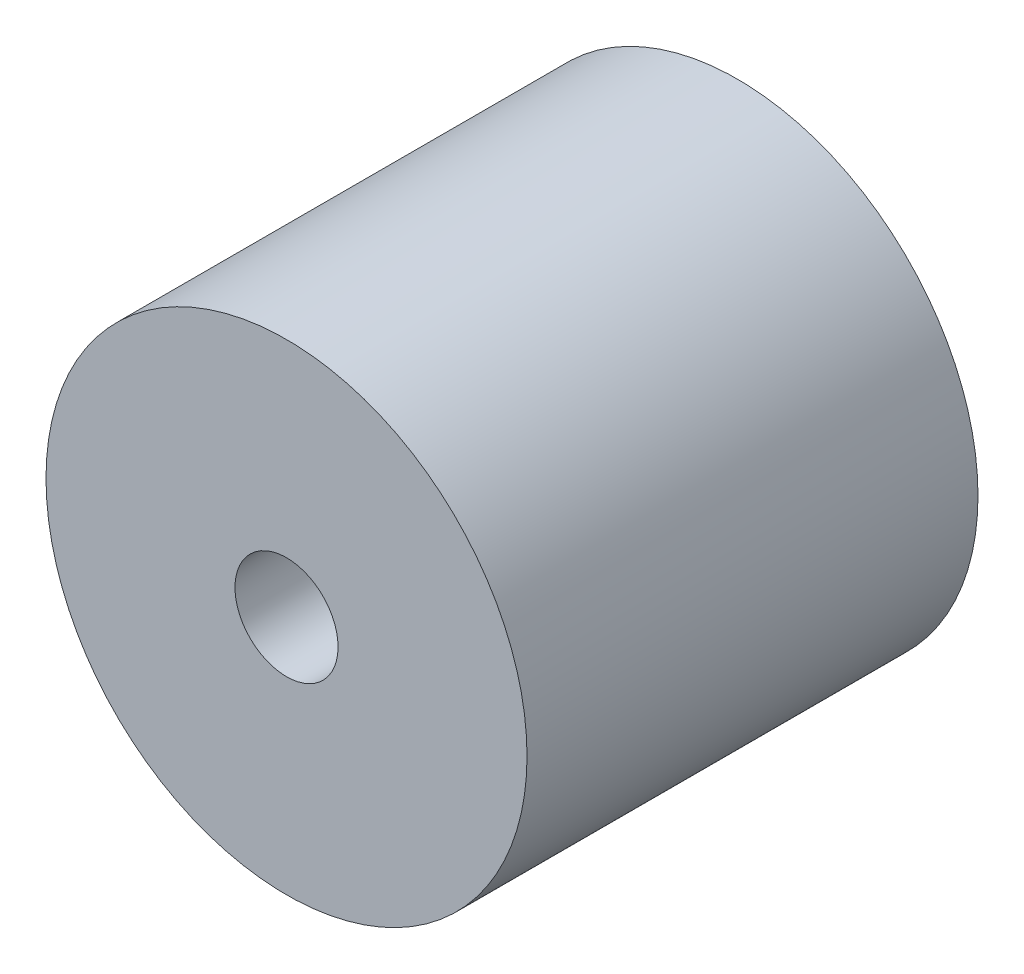
from build123d import *

# Parameters (mm, degrees)
CROQUIS1_R              = 16
CROQUIS1_R_2            = 3.429520741
SALIENTE_EXTRUIR1_DEPTH = 30


with BuildPart() as part:
    # Croquis1 → Saliente-Extruir1 (new body)
    with BuildSketch(Plane.XY):
        Circle(CROQUIS1_R)
        Circle(CROQUIS1_R_2, mode=Mode.SUBTRACT)
    extrude(amount=SALIENTE_EXTRUIR1_DEPTH)


solid = part.part
